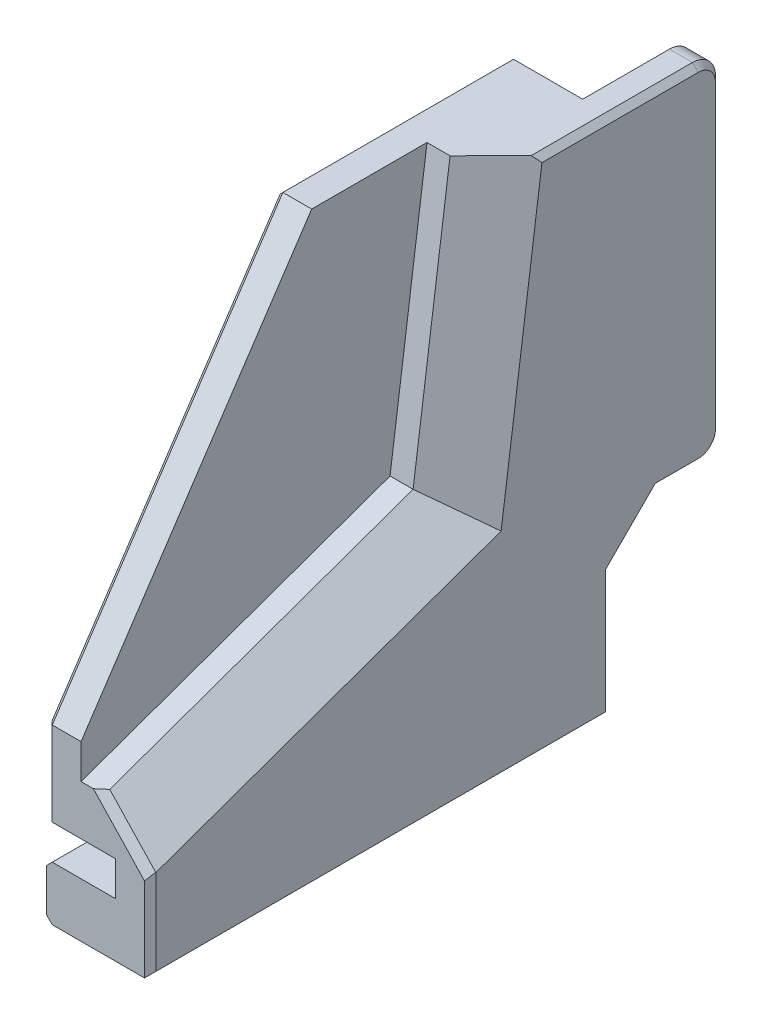
from build123d import *
from OCP.BRepFilletAPI import BRepFilletAPI_MakeChamfer

# Parameters (mm, degrees)
SKETCH1_W           = 9
SKETCH1_H           = 45
SKETCH1_R           = 1.63195
BOSS_EXTRUDE1_DEPTH = 40
SKETCH1_3_R         = 1.63195
CUT_EXTRUDE1_DEPTH  = 10
SKETCH2_W           = 40
SKETCH2_H           = 3
CUT_EXTRUDE2_DEPTH  = 6
CUT_EXTRUDE3_DEPTH  = 9
CUT_EXTRUDE4_DEPTH  = 6
CHAMFER2_SIZE       = 4
SKETCH6_R           = 2.0193
CUT_EXTRUDE5_DEPTH  = 6
SKETCH7_W           = 3
SKETCH7_H           = 30
BOSS_EXTRUDE3_DEPTH = 9.52
CHAMFER3_SIZE       = 4
FILLET1_R           = 2
CHAMFER4_SIZE       = 0.5
CHAMFER4_SIZE2      = 0.681231536
SKETCH8_W           = 73.765636672
SKETCH8_H           = 62.769253432
CUT_EXTRUDE6_DEPTH  = 9


with BuildPart() as part:
    # Sketch1 → Boss-Extrude1 (new body)
    # profile 1 of 3: a face of its own
    with BuildSketch(Plane.XY):
        with Locations((4.5, 22.5)):
            Rectangle(SKETCH1_W, SKETCH1_H)
        with Locations((6, 13)):
            Circle(SKETCH1_R, mode=Mode.SUBTRACT)
        with Locations((6, 25)):
            Circle(SKETCH1_R, mode=Mode.SUBTRACT)
    # profile 2 of 3: a face of its own
    with BuildSketch(Plane.XY):
        with Locations((6, 25)):
            Circle(SKETCH1_R)
    # profile 3 of 3: a face of its own
    with BuildSketch(Plane.XY):
        with Locations((6, 13)):
            Circle(SKETCH1_R)
    extrude(amount=BOSS_EXTRUDE1_DEPTH)

    # Sketch1<3> → Cut-Extrude1 (cut)
    with BuildSketch(Plane.XY):
        with Locations((6, 25)):
            Circle(SKETCH1_3_R)
        with Locations((6, 13)):
            Circle(SKETCH1_3_R)
    extrude(amount=CUT_EXTRUDE1_DEPTH, mode=Mode.SUBTRACT)

    # Sketch2 → Cut-Extrude2 (cut)
    with BuildSketch(Plane(origin=(9, 0, 0), x_dir=(0, 0, -1), z_dir=(1, 0, 0))):
        with Locations((-20, 6.2)):
            Rectangle(SKETCH2_W, SKETCH2_H)
    extrude(amount=-CUT_EXTRUDE2_DEPTH, mode=Mode.SUBTRACT)

    # Sketch3 → Cut-Extrude3 (cut)
    with BuildSketch(Plane(origin=(9, 0, 0), x_dir=(0, 0, -1), z_dir=(1, 0, 0))):
        Polygon((-20, 45), (-40, 15), (-48.379363257, 51.913157268), align=None)
    extrude(amount=-CUT_EXTRUDE3_DEPTH, mode=Mode.SUBTRACT)

    # Sketch5 → Cut-Extrude4 (cut)
    with BuildSketch(Plane.ZY):
        Polygon((20, 45), (10, 45), (13.204776383, 21.55213026), (40, 12), (40, 15), align=None)
    extrude(amount=-CUT_EXTRUDE4_DEPTH, mode=Mode.SUBTRACT)

    # Chamfer2
    chamfer2_edges = [part.edges().sort_by_distance(p)[0] for p in [
        (0, 33.27606513, 11.602388192),
        (0, 16.77606513, 26.602388192),
    ]]
    chamfer(chamfer2_edges, length=CHAMFER2_SIZE)

    # Sketch6 → Cut-Extrude5 (cut)
    with BuildSketch(Plane.XZ):
        with Locations(Location((5.5, 35, 0), (0, 0, 270))):
            Circle(SKETCH6_R)
        with Locations(Location((5.5, 20, 0), (0, 0, 270))):
            Circle(SKETCH6_R)
    extrude(amount=-CUT_EXTRUDE5_DEPTH, mode=Mode.SUBTRACT)

    # Sketch7 → Boss-Extrude3 (add)
    with BuildSketch(Plane(origin=(0, 0, 0), x_dir=(-1, 0, 0), z_dir=(0, 0, -1))):
        with Locations((-1.5, 30)):
            Rectangle(SKETCH7_W, SKETCH7_H)
    extrude(amount=BOSS_EXTRUDE3_DEPTH)

    # Chamfer3
    chamfer3_edges = [part.edges().sort_by_distance(p)[0] for p in [
        (1.5, 15, 0),
    ]]
    chamfer(chamfer3_edges, length=CHAMFER3_SIZE)

    # Fillet1
    fillet1_edges = [part.edges().sort_by_distance(p)[0] for p in [
        (1.5, 45, -9.52),
        (1.5, 15, -9.52),
    ]]
    fillet(fillet1_edges, radius=FILLET1_R)

    # Chamfer4: one chamfer whose edges measure the first distance from different faces: ONE call of the kernel's chamfer builder (chamfer() names one face for all edges)
    chamfer4_edges_1 = [part.edges().sort_by_distance(p)[0] for p in [
        (3, 45, -3.76),
        (3, 44.414213562, -8.934213562),
        (3, 15, -5.76),
        (3, 30, -9.52),
        (3, 15.585786438, -8.934213562),
        (3, 13, -2),
        (9, 7.7, 20),
        (9, 4.7, 20),
        (0, 3.876717178, 40),
        (0, 0, 20),
        (0, 5.5, 0),
        (0, 13, -2),
        (0, 15, -5.76),
        (0, 45, -0.778594073),
        (0, 15.585786438, -8.934213562),
        (0, 44.414213562, -8.934213562),
        (0, 30, -9.52),
        (9, 0, 20),
        (9, 11.35, 40),
        (9, 30, 30),
        (9, 45, 10),
        (9, 26.35, 0),
    ]]
    chamfer4_edges_2 = [part.edges().sort_by_distance(p)[0] for p in [
        (2, 9.876717178, 40),
    ]]
    chamfer4_side_2 = [part.faces().sort_by_distance(p)[0] for p in [
        (1.957665589, 14.938546455, 25.674700071),
    ]]
    chamfer4 = BRepFilletAPI_MakeChamfer(part.part.solid().wrapped)
    for e in chamfer4_edges_1:
        chamfer4.Add(CHAMFER4_SIZE, e.wrapped)
    for e in chamfer4_edges_2:
        chamfer4.Add(CHAMFER4_SIZE, CHAMFER4_SIZE2, e.wrapped, chamfer4_side_2[0].wrapped)  # the first distance lies on this face
    add(Compound.cast(chamfer4.Shape()), mode=Mode.REPLACE)

    # Mirror1: part across plane


with BuildPart() as part_1:
    add(part.part)
    add(part.part.mirror(Plane(origin=(9, 0, 40), x_dir=(0, 0, 1), z_dir=(-1, 0, 0))))

    # Sketch8 → Cut-Extrude6 (cut)
    with BuildSketch(Plane.ZY):
        with Locations((15.385718854, 24.547909709)):
            Rectangle(SKETCH8_W, SKETCH8_H)
    extrude(amount=-CUT_EXTRUDE6_DEPTH, mode=Mode.SUBTRACT)


solid = part_1.part
